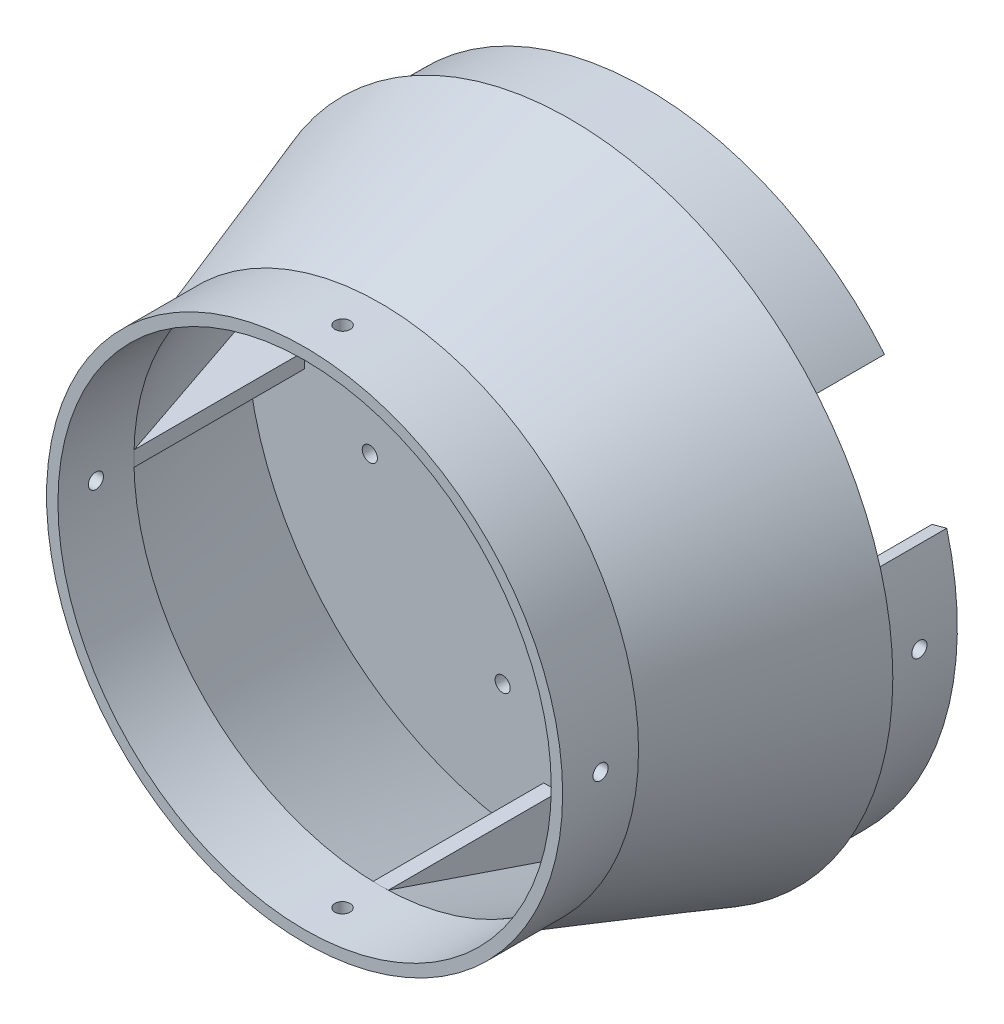
from build123d import *

# Parameters (mm, degrees)
BOSS_EXTRUDE5_DEPTH             = 2
CIRPATTERN3_COUNT               = 4
BOSS_EXTRUDE6_DEPTH             = 20
SKETCH14_R                      = 2
CUT_EXTRUDE1_DEPTH              = 95
CIRPATTERN4_COUNT               = 4
FILLET1_R                       = 5
SKETCH16_R                      = 2
CUT_EXTRUDE2_DEPTH              = 94
CIRPATTERN5_COUNT               = 2
CIRPATTERN5_ANGLE               = 90
CIRPATTERN5_THE_OTHER_WAY_COUNT = 2
CIRPATTERN5_THE_OTHER_WAY_ANGLE = 90
SKETCH17_R                      = 2
CUT_EXTRUDE4_DEPTH              = 900
CUT_EXTRUDE7_START              = -20
CUT_EXTRUDE7_DEPTH              = 20


with BuildPart() as part:
    # Sketch10 → Revolve2 (revolve)
    with BuildSketch(Plane(origin=(0, 0, 0), x_dir=(1, 0, 0), z_dir=(0, 1, 0))):
        Polygon((68, 0), (85, 50), (0, 50), (0, 45), (80.3, 45), (65, 0), (65, -20), (68, -20), align=None)
    revolve(axis=Axis((0, 0, 0), (0, 0, -1)))

    # Sketch12 → Boss-Extrude5 (add, symmetric)
    with BuildSketch(Plane(origin=(0, 0, 0), x_dir=(1, 0, 0), z_dir=(0, 1, 0))):
        Polygon((-80.3, 45), (-65, 0), (-65, 45), align=None)
    boss_extrude5 = extrude(amount=BOSS_EXTRUDE5_DEPTH, both=True)

    # CirPattern3: Boss-Extrude5 ×4 about axis
    cirpattern3_axis = Axis((0, 0, -50), (0, 0, 1))
    for i in range(1, CIRPATTERN3_COUNT):
        add(boss_extrude5.rotate(cirpattern3_axis, i * 360 / CIRPATTERN3_COUNT))

    # Sketch13 → Boss-Extrude6 (add)
    with BuildSketch(Plane(origin=(0, 0, -50), x_dir=(-1, 0, 0), z_dir=(0, 0, -1))):
        with BuildLine():
            ThreePointArc((82, 0), (78.943017424, 22.181073013), (70, 42.708313008))
            ThreePointArc((70, 42.708313008), (-82, 0), (70, -42.708313008))
            ThreePointArc((70, -42.708313008), (78.943017424, -22.181073013), (82, 0))
        make_face()
        with BuildLine():
            ThreePointArc((70, -34.409301068), (-78, 0), (70, 34.409301068))
            ThreePointArc((70, 34.409301068), (75.973679653, 17.663521733), (78, 0))
            ThreePointArc((78, 0), (75.973679653, -17.663521733), (70, -34.409301068))
        make_face(mode=Mode.SUBTRACT)
    extrude(amount=BOSS_EXTRUDE6_DEPTH)

    # Sketch14 → Cut-Extrude1 (cut)
    with BuildSketch(Plane(origin=(0, 0, 0), x_dir=(1, 0, 0), z_dir=(0, 1, 0))):
        with Locations((0, -10)):
            Circle(SKETCH14_R)
    cut_extrude1 = extrude(amount=-CUT_EXTRUDE1_DEPTH, mode=Mode.SUBTRACT)

    # CirPattern4: Cut-Extrude1 ×4 about axis
    cirpattern4_axis = Axis((0, 0, 20), (0, 0, 1))
    for i in range(1, CIRPATTERN4_COUNT):
        add(cut_extrude1.rotate(cirpattern4_axis, i * 360 / CIRPATTERN4_COUNT), mode=Mode.SUBTRACT)

    # Fillet1
    fillet1_edges = [part.edges().sort_by_distance(p)[0] for p in [
        (70, -34.409301068, -50),
    ]]
    fillet(fillet1_edges, radius=FILLET1_R)

    # Sketch16 → Cut-Extrude2 (cut)
    with BuildSketch(Plane(origin=(0, 0, 0), x_dir=(1, 0, 0), z_dir=(0, 1, 0))):
        with Locations((0, 60)):
            Circle(SKETCH16_R)
    cut_extrude2 = extrude(amount=-CUT_EXTRUDE2_DEPTH, mode=Mode.SUBTRACT)

    # CirPattern5: Cut-Extrude2 ×2 about axis
    cirpattern5_axis = Axis((0, 0, -70), (0, 0, -1))
    for i in range(1, CIRPATTERN5_COUNT):
        add(cut_extrude2.rotate(cirpattern5_axis, i * CIRPATTERN5_ANGLE / (CIRPATTERN5_COUNT - 1)), mode=Mode.SUBTRACT)

    # CirPattern5 the other way: Cut-Extrude2 ×2 about axis
    cirpattern5_the_other_way_axis = Axis((0, 0, -70), (0, 0, 1))
    for i in range(1, CIRPATTERN5_THE_OTHER_WAY_COUNT):
        add(cut_extrude2.rotate(cirpattern5_the_other_way_axis, i * CIRPATTERN5_THE_OTHER_WAY_ANGLE / (CIRPATTERN5_THE_OTHER_WAY_COUNT - 1)), mode=Mode.SUBTRACT)

    # Sketch17 → Cut-Extrude4 (cut)
    with BuildSketch(Plane(origin=(0, 0, -50), x_dir=(-1, 0, 0), z_dir=(0, 0, -1))):
        with Locations((-47.813328401, 12.811542733)):
            Circle(SKETCH17_R)
        with Locations((-12.811542733, 47.813328401)):
            Circle(SKETCH17_R)
        with Locations((12.811542733, -47.813328401)):
            Circle(SKETCH17_R)
        with Locations((47.813328401, -12.811542733)):
            Circle(SKETCH17_R)
    extrude(amount=-CUT_EXTRUDE4_DEPTH, mode=Mode.SUBTRACT)

    # Sketch19 → Cut-Extrude7 (cut)
    with BuildSketch(Plane(origin=(0, 0, -70), x_dir=(-1, 0, 0), z_dir=(0, 0, -1)).offset(CUT_EXTRUDE7_START)):
        with BuildLine():
            Line((0, 0), (-79.205917756, 21.223161698))
            ThreePointArc((-79.205917756, 21.223161698), (-72.734888321, 37.863386285), (-62.815644336, 52.708583994))
            Line((-62.815644336, 52.708583994), (0, 0))
        make_face()
    cut_extrude7 = extrude(amount=CUT_EXTRUDE7_DEPTH, mode=Mode.SUBTRACT)

    # Mirror1: Cut-Extrude7 across plane
    add(cut_extrude7.mirror(Plane(origin=(0, 0, 0), x_dir=(0, 0, 1), z_dir=(1, 0, 0))), mode=Mode.SUBTRACT)


solid = part.part
